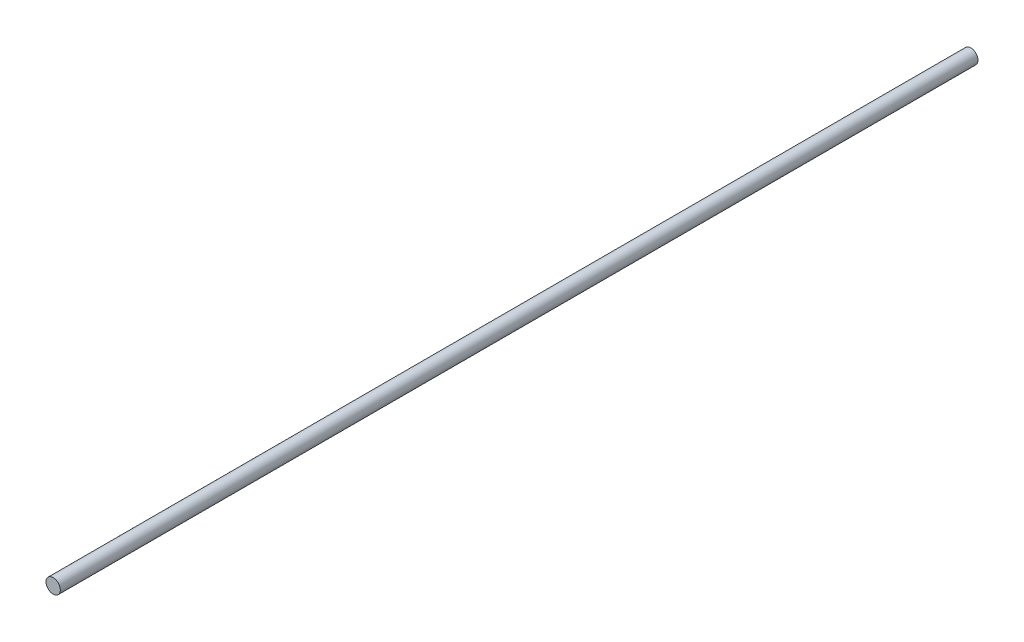
from build123d import *

# Parameters (mm, degrees)
SKETCH1_R           = 1.5875
BOSS_EXTRUDE1_DEPTH = 101.6


with BuildPart() as part:
    # Sketch1 → Boss-Extrude1 (new, symmetric)
    with BuildSketch(Plane.XY):
        Circle(SKETCH1_R)
    extrude(amount=BOSS_EXTRUDE1_DEPTH, both=True)


solid = part.part
